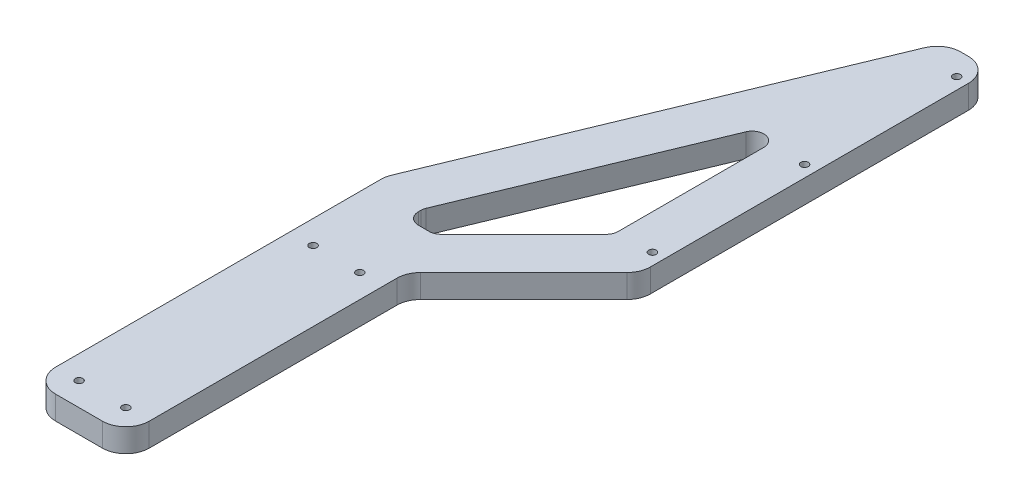
from build123d import *

# Parameters (mm, degrees)
BOSS_EXTRUDE1_DEPTH     = 10
CUT_EXTRUDE1_DEPTH      = 333.565782966
CUT_EXTRUDE1_DEPTH_BACK = 333.565782966
SKETCH2_R               = 1.6
FILLET2_R               = 5
CUT_EXTRUDE3_DEPTH      = 333.565782966
CUT_EXTRUDE3_DEPTH_BACK = 333.565782966
SKETCH4_R               = 1.6
FILLET3_R               = 10


with BuildPart() as part:
    # Sketch1 → Boss-Extrude1 (new body)
    with BuildSketch(Plane(origin=(0, 0, 0), x_dir=(1, 0, 0), z_dir=(0, 1, 0))):
        Polygon((0, 120), (0, 151.005050634), (70, 320), (90, 320), (90, 170), (40, 120), (40, 0), (0, 0), align=None)
        Polygon((20, 147.026803286), (70, 267.737481405), (70, 178.284271247), (31.715728753, 140), (20, 140), align=None, mode=Mode.SUBTRACT)
    extrude(amount=BOSS_EXTRUDE1_DEPTH)

    # Sketch2 → Cut-Extrude1 (cut, two sides: drawn at the far end of the back side and taken through both)
    with BuildSketch(Plane(origin=(0, 10, 0), x_dir=(1, 0, 0), z_dir=(0, 1, 0)).offset(-CUT_EXTRUDE1_DEPTH_BACK)):
        with Locations(Location((10, 110, 0), (0, 0, 270))):
            Circle(SKETCH2_R)
        with Locations(Location((30, 110, 0), (0, 0, 270))):
            Circle(SKETCH2_R)
        with Locations(Location((10, 10, 0), (0, 0, 270))):
            Circle(SKETCH2_R)
        with Locations(Location((30, 10, 0), (0, 0, 270))):
            Circle(SKETCH2_R)
    extrude(amount=CUT_EXTRUDE1_DEPTH + CUT_EXTRUDE1_DEPTH_BACK, mode=Mode.SUBTRACT)

    # Fillet2
    fillet2_edges = [part.edges().sort_by_distance(p)[0] for p in [
        (20, 5, -147.026803286),
        (20, 5, -140),
        (31.715728753, 5, -140),
        (70, 5, -178.284271247),
        (70, 5, -267.737481405),
    ]]
    fillet(fillet2_edges, radius=FILLET2_R)

    # Sketch4 → Cut-Extrude3 (cut, two sides: drawn at the far end of the back side and taken through both)
    with BuildSketch(Plane(origin=(0, 10, 0), x_dir=(1, 0, 0), z_dir=(0, 1, 0)).offset(-CUT_EXTRUDE3_DEPTH_BACK)):
        with Locations(Location((85, 310, 0), (0, 0, 270))):
            Circle(SKETCH4_R)
        with Locations(Location((85, 245, 0), (0, 0, 270))):
            Circle(SKETCH4_R)
        with Locations(Location((85, 180, 0), (0, 0, 270))):
            Circle(SKETCH4_R)
    extrude(amount=CUT_EXTRUDE3_DEPTH + CUT_EXTRUDE3_DEPTH_BACK, mode=Mode.SUBTRACT)

    # Fillet3
    fillet3_edges = [part.edges().sort_by_distance(p)[0] for p in [
        (0, 5, -151.005050634),
        (70, 5, -320),
        (90, 5, -320),
        (90, 5, -170),
        (40, 5, -120),
        (40, 5, 0),
        (0, 5, 0),
    ]]
    fillet(fillet3_edges, radius=FILLET3_R)


solid = part.part
